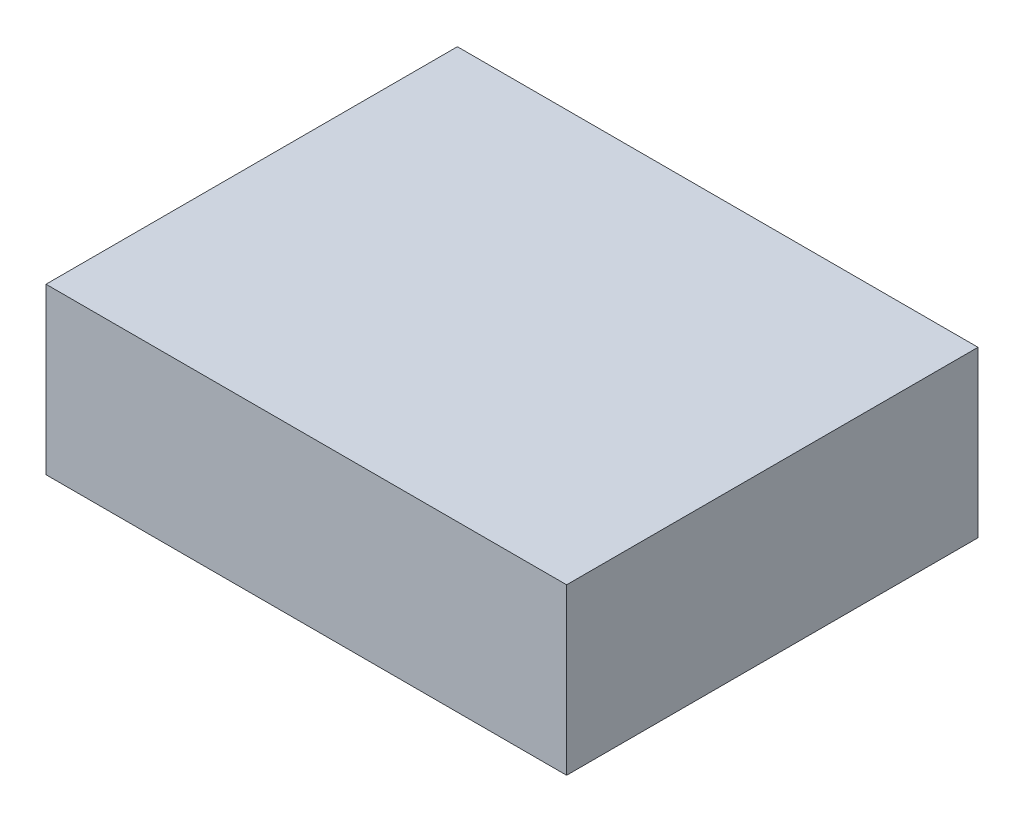
from build123d import *

# Parameters (mm, degrees)
SKETCH1_W           = 31.555582278
SKETCH1_H           = 24.934680119
BOSS_EXTRUDE1_DEPTH = 10


with BuildPart() as part:
    # Sketch1 → Boss-Extrude1 (new body)
    with BuildSketch(Plane(origin=(0, 0, 0), x_dir=(1, 0, 0), z_dir=(0, 1, 0))):
        with Locations((-4.52393252, -6.919039481)):
            Rectangle(SKETCH1_W, SKETCH1_H)
    extrude(amount=BOSS_EXTRUDE1_DEPTH)


solid = part.part
